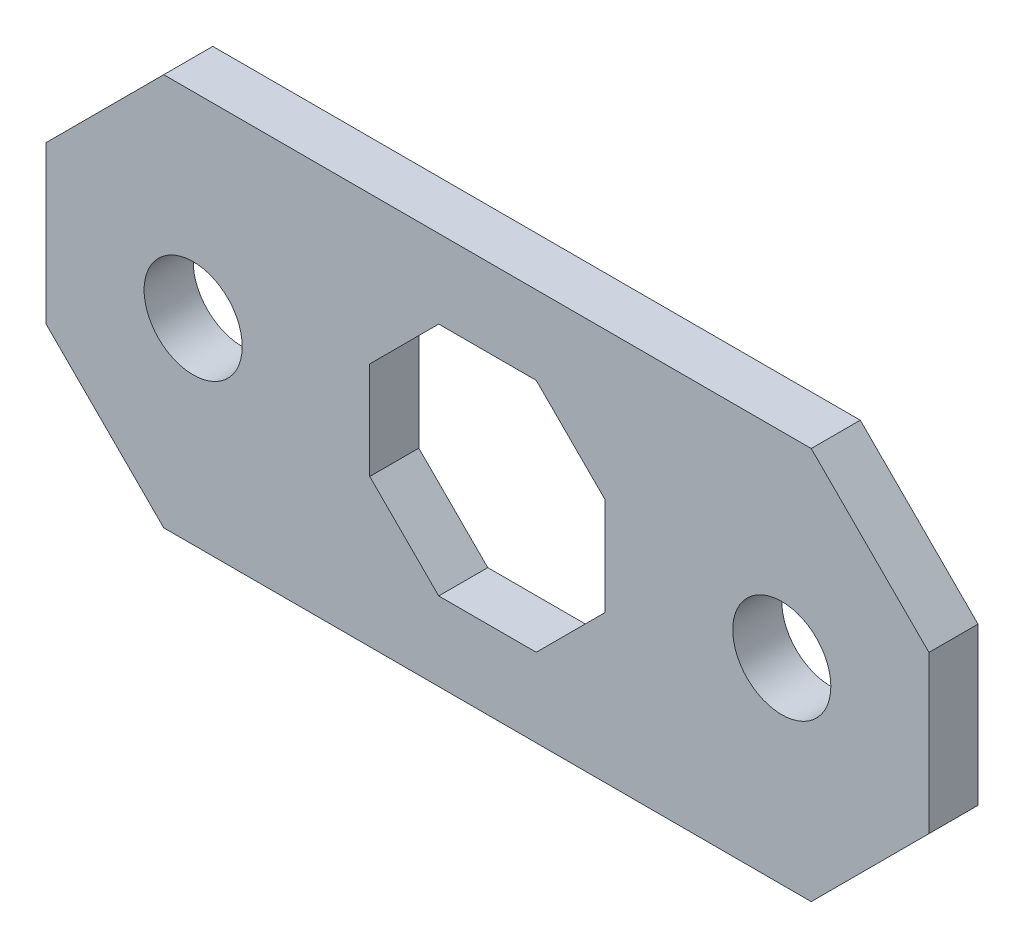
from build123d import *

# Parameters (mm, degrees)
SKETCH2_W           = 57.15
SKETCH2_H           = 25.4
BOSS_EXTRUDE1_DEPTH = 3.175
HOLE1_D             = 6.35
CHAMFER1_SIZE       = 7.62
CUT_EXTRUDE1_DEPTH  = 32.430896424


with BuildPart() as part:
    # Sketch2 → Boss-Extrude1 (new body)
    with BuildSketch(Plane.XY):
        Rectangle(SKETCH2_W, SKETCH2_H)
    extrude(amount=BOSS_EXTRUDE1_DEPTH)

    # Hole1 (through all)
    with Locations(Plane.XY.offset(3.175)):
        with Locations((-19.05, 0), (19.05, 0)):
            Hole(HOLE1_D / 2)

    # Chamfer1
    chamfer1_edges = [part.edges().sort_by_distance(p)[0] for p in [
        (28.575, -12.7, 1.5875),
        (-28.575, -12.7, 1.5875),
        (-28.575, 12.7, 1.5875),
        (28.575, 12.7, 1.5875),
    ]]
    chamfer(chamfer1_edges, length=CHAMFER1_SIZE)

    # Sketch5 → Cut-Extrude1 (cut, through all)
    with BuildSketch(Plane.XY.offset(3.175)):
        Polygon((7.62, 3.156307345), (3.156307345, 7.62), (-3.156307345, 7.62), (-7.62, 3.156307345), (-7.62, -3.156307345), (-3.156307345, -7.62), (3.156307345, -7.62), (7.62, -3.156307345), align=None)
    extrude(amount=-CUT_EXTRUDE1_DEPTH, mode=Mode.SUBTRACT)


solid = part.part
